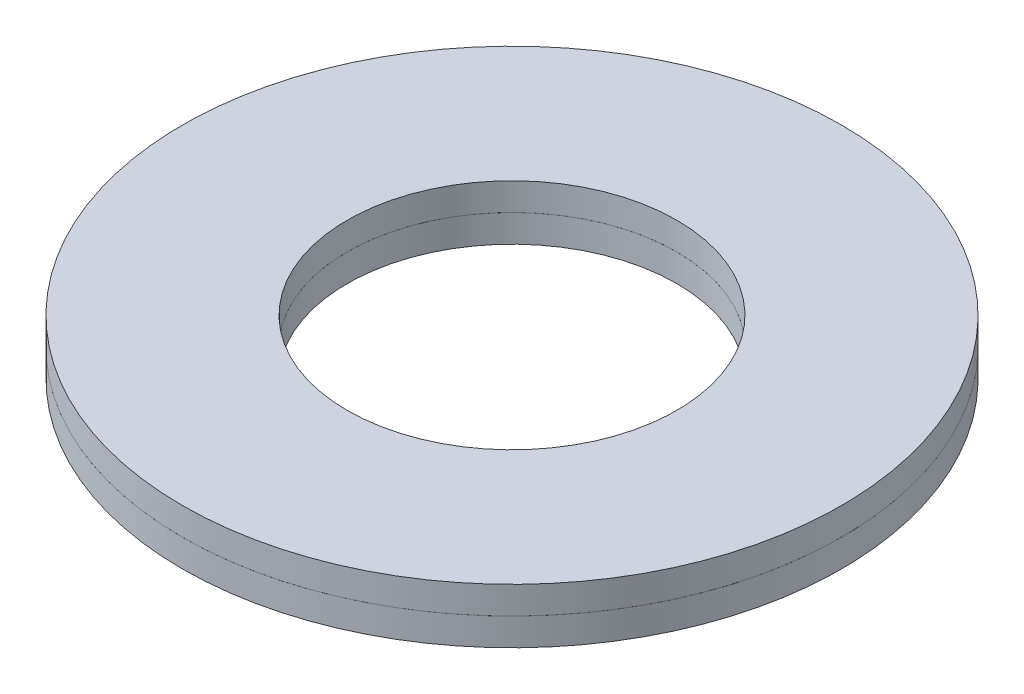
from build123d import *

# Parameters (mm, degrees)
SKETCH1_W = 60
SKETCH1_H = 10


with BuildPart() as part:
    # Sketch1 → Revolve1 (revolve)
    with BuildSketch(Plane(origin=(0, 0, 0), x_dir=(0, 0, -1), z_dir=(1, 0, 0))):
        with Locations((-90, 5.005)):
            Rectangle(SKETCH1_W, SKETCH1_H)
        with Locations((-90, -5.005)):
            Rectangle(SKETCH1_W, SKETCH1_H)
    revolve(axis=Axis((0, 64.898114619, 0), (0, -1, 0)))


solid = part.part
